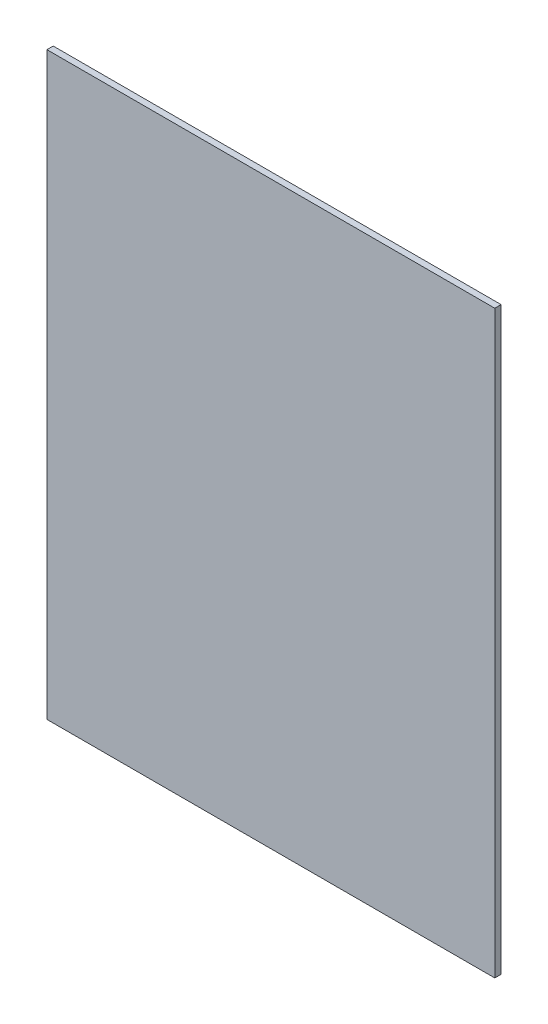
from build123d import *

# Parameters (mm, degrees)
SKETCH2_W           = 225.552
SKETCH2_H           = 292.1
BOSS_EXTRUDE1_DEPTH = 3.175


with BuildPart() as part:
    # Sketch2 → Boss-Extrude1 (new body)
    with BuildSketch(Plane.XY):
        with Locations((112.776, 146.05)):
            Rectangle(SKETCH2_W, SKETCH2_H)
    extrude(amount=BOSS_EXTRUDE1_DEPTH)


solid = part.part
